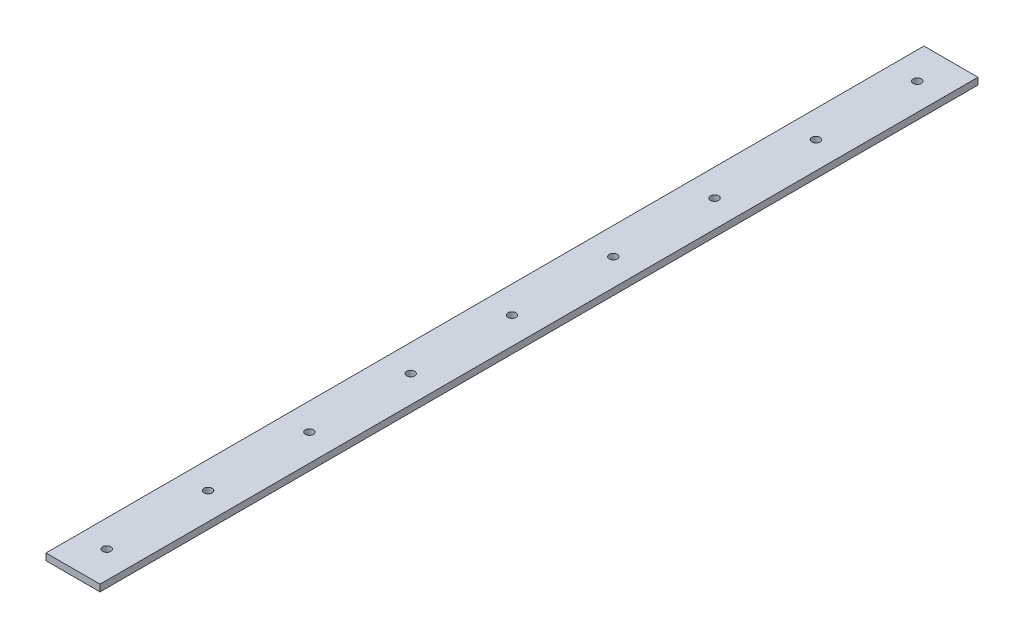
from build123d import *

# Parameters (mm, degrees)
SKETCH1_W               = 40
SKETCH1_H               = 650
BOSS_EXTRUDE1_DEPTH     = 5
CUT_EXTRUDE1_DEPTH      = 326.653189759
CUT_EXTRUDE1_DEPTH_BACK = 326.653189759
SKETCH2_R               = 3


with BuildPart() as part:
    # Sketch1 → Boss-Extrude1 (new body)
    with BuildSketch(Plane(origin=(0, 0, 0), x_dir=(1, 0, 0), z_dir=(0, 1, 0))):
        Rectangle(SKETCH1_W, SKETCH1_H)
    extrude(amount=BOSS_EXTRUDE1_DEPTH)

    # Sketch2 → Cut-Extrude1 (cut, two sides: drawn at the far end of the back side and taken through both)
    with BuildSketch(Plane(origin=(0, 0, 0), x_dir=(1, 0, 0), z_dir=(0, 1, 0)).offset(-CUT_EXTRUDE1_DEPTH_BACK)):
        with Locations(Location((0, 0, 0), (0, 0, 90))):
            Circle(SKETCH2_R)
        with Locations(Location((0, 75, 0), (0, 0, 90))):
            Circle(SKETCH2_R)
        with Locations(Location((0, 150, 0), (0, 0, 90))):
            Circle(SKETCH2_R)
        with Locations(Location((0, 225, 0), (0, 0, 90))):
            Circle(SKETCH2_R)
        with Locations(Location((0, 300, 0), (0, 0, 90))):
            Circle(SKETCH2_R)
        with Locations(Location((0, -300, 0), (0, 0, 90))):
            Circle(SKETCH2_R)
        with Locations(Location((0, -225, 0), (0, 0, 90))):
            Circle(SKETCH2_R)
        with Locations(Location((0, -150, 0), (0, 0, 90))):
            Circle(SKETCH2_R)
        with Locations(Location((0, -75, 0), (0, 0, 90))):
            Circle(SKETCH2_R)
    extrude(amount=CUT_EXTRUDE1_DEPTH + CUT_EXTRUDE1_DEPTH_BACK, mode=Mode.SUBTRACT)


solid = part.part
